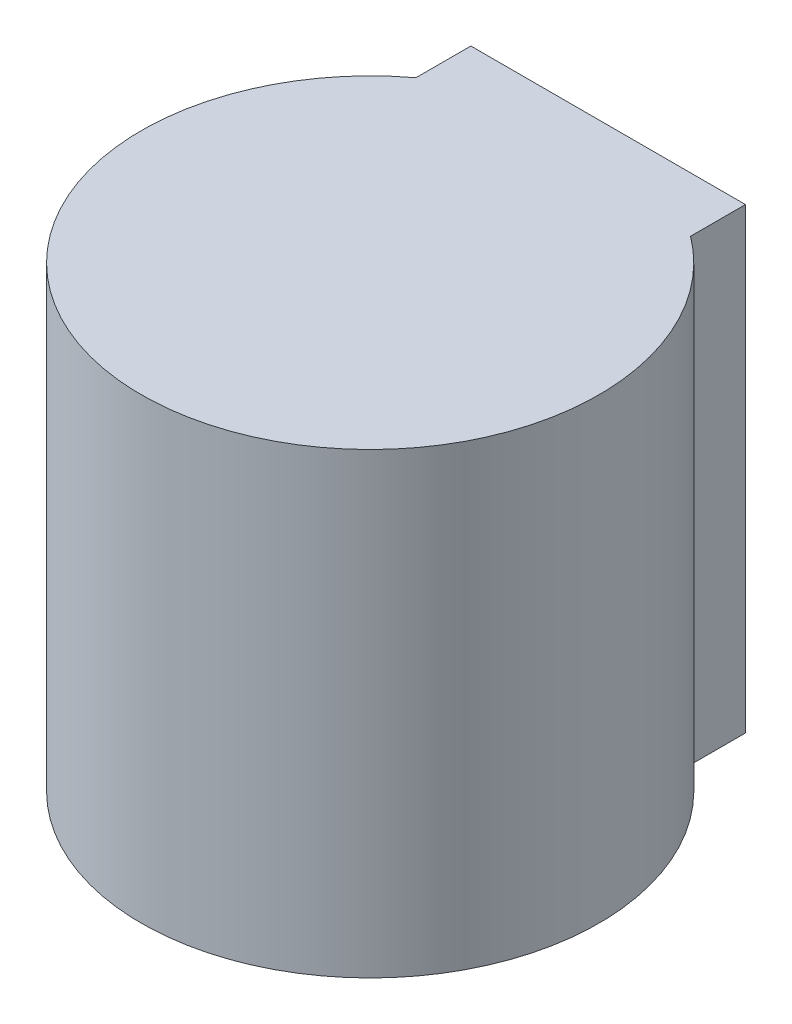
from build123d import *

# Parameters (mm, degrees)
SKETCH_1_R      = 250
EXTRUDE_1_DEPTH = 500
SKETCH_2_W      = 300
SKETCH_2_H      = 500
EXTRUDE_2_DEPTH = 260


with BuildPart() as part:
    # Эскиз1 → Бобышка-Вытянуть1 (new body)
    with BuildSketch(Plane(origin=(0, 0, 0), x_dir=(1, 0, 0), z_dir=(0, 1, 0))):
        with Locations(Location((0, 0, 0), (0, 0, 270))):
            Circle(SKETCH_1_R)
    extrude(amount=EXTRUDE_1_DEPTH)

    # Эскиз2 → Бобышка-Вытянуть2 (add)
    with BuildSketch(Plane.XY):
        with Locations((0, 250)):
            Rectangle(SKETCH_2_W, SKETCH_2_H)
    extrude(amount=-EXTRUDE_2_DEPTH)


solid = part.part
